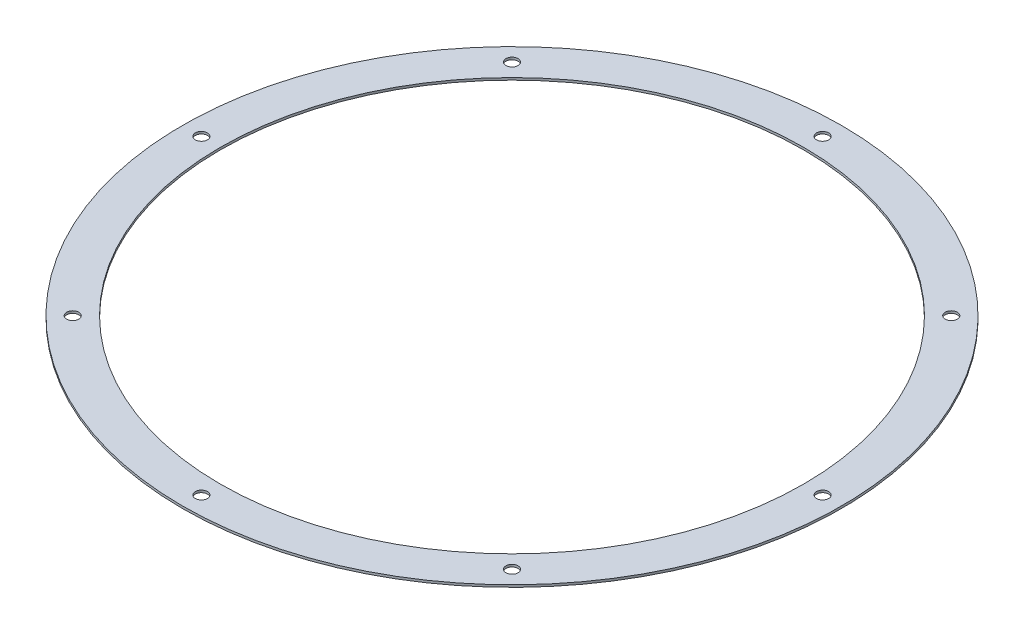
from build123d import *

# Parameters (mm, degrees)
SKETCH1_R               = 435
SKETCH1_R_2             = 385
BOSS_EXTRUDE1_DEPTH     = 1.5
CUT_EXTRUDE1_DEPTH      = 616.190214487
CUT_EXTRUDE1_DEPTH_BACK = 616.190214487
SKETCH2_R               = 8


with BuildPart() as part:
    # Sketch1 → Boss-Extrude1 (new, symmetric)
    with BuildSketch(Plane(origin=(0, 0, 0), x_dir=(1, 0, 0), z_dir=(0, 1, 0))):
        with Locations(Location((0, 0, 0), (0, 0, 270))):
            Circle(SKETCH1_R)
        with Locations(Location((0, 0, 0), (0, 0, 270))):
            Circle(SKETCH1_R_2, mode=Mode.SUBTRACT)
    extrude(amount=BOSS_EXTRUDE1_DEPTH, both=True)

    # Sketch2 → Cut-Extrude1 (cut, two sides: drawn at the far end of the back side and taken through both)
    with BuildSketch(Plane(origin=(0, 1.5, 0), x_dir=(1, 0, 0), z_dir=(0, 1, 0)).offset(-CUT_EXTRUDE1_DEPTH_BACK)):
        with Locations(Location((410, 0, 0), (0, 0, 270))):
            Circle(SKETCH2_R)
        with Locations(Location((289.913780286, -289.913780286, 0), (0, 0, 270))):
            Circle(SKETCH2_R)
        with Locations(Location((0, -410, 0), (0, 0, 270))):
            Circle(SKETCH2_R)
        with Locations(Location((-289.913780286, -289.913780286, 0), (0, 0, 270))):
            Circle(SKETCH2_R)
        with Locations(Location((-410, 0, 0), (0, 0, 270))):
            Circle(SKETCH2_R)
        with Locations(Location((-289.913780286, 289.913780286, 0), (0, 0, 270))):
            Circle(SKETCH2_R)
        with Locations(Location((0, 410, 0), (0, 0, 270))):
            Circle(SKETCH2_R)
        with Locations(Location((289.913780286, 289.913780286, 0), (0, 0, 270))):
            Circle(SKETCH2_R)
    extrude(amount=CUT_EXTRUDE1_DEPTH + CUT_EXTRUDE1_DEPTH_BACK, mode=Mode.SUBTRACT)


solid = part.part
